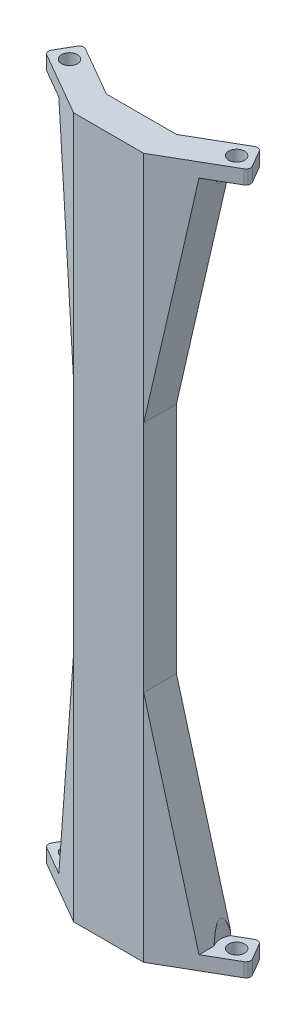
from build123d import *

# Parameters (mm, degrees)
SKETCH2_W            = 15
SKETCH2_H            = 150
BOSS_EXTRUDE1_DEPTH  = 3.5
BOSS_EXTRUDE2_DEPTH  = 150
CUT_EXTRUDE1_DEPTH   = 80.340414561
CUT_EXTRUDE2_REACH   = 150.982
SKETCH6_R            = 1.7
FILLET2_R            = 1
CUT_EXTRUDE3_REACH   = 150.982
SKETCH7_R            = 3.5
FILLET2_OF_MIRROR1_R = 1


with BuildPart() as part:
    # Sketch2 → Boss-Extrude1 (new, symmetric)
    with BuildSketch(Plane.XY):
        Rectangle(SKETCH2_W, SKETCH2_H)
    extrude(amount=BOSS_EXTRUDE1_DEPTH, both=True)

    # Sketch3 → Boss-Extrude2 (add)
    with BuildSketch(Plane.XZ.offset(75)):
        Polygon((-7.5, 3.5), (-22.005925513, -4.875), (-18.9748366, -10.125), (-7.5, -3.5), align=None)
        Polygon((7.5, 3.5), (22.005925513, -4.875), (18.9748366, -10.125), (7.5, -3.5), align=None)
    extrude(amount=-BOSS_EXTRUDE2_DEPTH)

    # Sketch5 → Cut-Extrude1 (cut, through all)
    with BuildSketch(Plane.XY.offset(3.5)):
        Polygon((-7.5, 25), (-7.5, -25), (-15.005925513, -72), (-22.005925513, -72), (-22.005925513, 72), (-15.005925513, 72), align=None)
        Polygon((22.005925513, -72), (15.005925513, -72), (7.5, -25), (7.5, 25), (15.005925513, 72), (22.005925513, 72), align=None)
    extrude(amount=-CUT_EXTRUDE1_DEPTH, mode=Mode.SUBTRACT)

    # Sketch6 → Cut-Extrude2 (cut, up to next)
    with BuildSketch(Plane(origin=(0, -72, 0), x_dir=(1, 0, 0), z_dir=(0, 1, 0)), mode=Mode.PRIVATE) as cut_extrude2_sk1:
        with Locations(Location((17.892304845, 6, 0), (0, 0, 270))):
            Circle(SKETCH6_R)
    cut_extrude2_tool1 = extrude(cut_extrude2_sk1.sketch, amount=-CUT_EXTRUDE2_REACH, mode=Mode.PRIVATE) & part.part
    # Sketch6 → Cut-Extrude2 (cut, up to next)
    with BuildSketch(Plane(origin=(0, -72, 0), x_dir=(1, 0, 0), z_dir=(0, 1, 0)), mode=Mode.PRIVATE) as cut_extrude2_sk2:
        with Locations(Location((-17.892304845, 6, 0), (0, 0, 270))):
            Circle(SKETCH6_R)
    cut_extrude2_tool2 = extrude(cut_extrude2_sk2.sketch, amount=-CUT_EXTRUDE2_REACH, mode=Mode.PRIVATE) & part.part
    cut_extrude2_1 = cut_extrude2_tool1.solids().sort_by_distance((17.892305, -72, -6))[0]
    add(cut_extrude2_1, mode=Mode.SUBTRACT)
    cut_extrude2_2 = cut_extrude2_tool2.solids().sort_by_distance((-17.892305, -72, -6))[0]
    add(cut_extrude2_2, mode=Mode.SUBTRACT)
    cut_extrude2 = cut_extrude2_1 + cut_extrude2_2  # Cut-Extrude2 as one shape, for the pattern or mirror that repeats it

    # Fillet2
    fillet2_edges = [part.edges().sort_by_distance(p)[0] for p in [
        (18.9748366, -73.5, -10.125),
        (22.005925513, -73.5, -4.875),
        (-22.005925513, -73.5, -4.875),
        (-18.9748366, -73.5, -10.125),
    ]]
    fillet(fillet2_edges, radius=FILLET2_R)

    # Sketch7 → Cut-Extrude3 (cut, up to next)
    with BuildSketch(Plane(origin=(0, -72, 0), x_dir=(1, 0, 0), z_dir=(0, 1, 0)), mode=Mode.PRIVATE) as cut_extrude3_sk1:
        with Locations((-17.892304845, 6)):
            Circle(SKETCH7_R)
    cut_extrude3_tool1 = extrude(cut_extrude3_sk1.sketch, amount=CUT_EXTRUDE3_REACH, mode=Mode.PRIVATE) & part.part
    # Sketch7 → Cut-Extrude3 (cut, up to next)
    with BuildSketch(Plane(origin=(0, -72, 0), x_dir=(1, 0, 0), z_dir=(0, 1, 0)), mode=Mode.PRIVATE) as cut_extrude3_sk2:
        with Locations((17.892304845, 6)):
            Circle(SKETCH7_R)
    cut_extrude3_tool2 = extrude(cut_extrude3_sk2.sketch, amount=CUT_EXTRUDE3_REACH, mode=Mode.PRIVATE) & part.part
    cut_extrude3_1 = cut_extrude3_tool1.solids().sort_by_distance((-17.892305, -72, -6))[0]
    add(cut_extrude3_1, mode=Mode.SUBTRACT)
    cut_extrude3_2 = cut_extrude3_tool2.solids().sort_by_distance((17.892305, -72, -6))[0]
    add(cut_extrude3_2, mode=Mode.SUBTRACT)
    cut_extrude3 = cut_extrude3_1 + cut_extrude3_2  # Cut-Extrude3 as one shape, for the pattern or mirror that repeats it

    # Mirror1: Cut-Extrude2, Cut-Extrude3 across plane
    add(cut_extrude2.mirror(Plane.ZX), mode=Mode.SUBTRACT)
    add(cut_extrude3.mirror(Plane.ZX), mode=Mode.SUBTRACT)

    # Fillet2 of Mirror1
    fillet2_of_mirror1_edges = [part.edges().sort_by_distance(p)[0] for p in [
        (18.9748366, 73.5, -10.125),
        (22.005925513, 73.5, -4.875),
        (-22.005925513, 73.5, -4.875),
        (-18.9748366, 73.5, -10.125),
    ]]
    fillet(fillet2_of_mirror1_edges, radius=FILLET2_OF_MIRROR1_R)


solid = part.part
